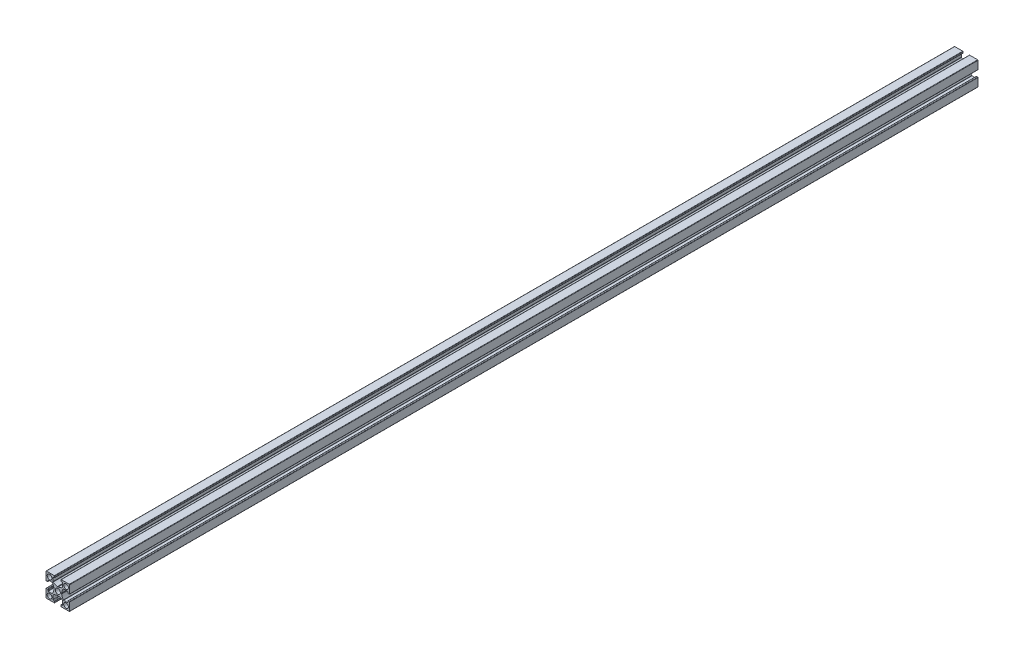
from build123d import *

# Parameters (mm, degrees)
MODEL_R         = 2.15
MODEL_R_2       = 2
EXTRUDE_1_DEPTH = 770


with BuildPart() as part:
    # Model → 보스-돌출1 (new body)
    with BuildSketch(Plane.XY):
        with BuildLine():
            Line((2307.763927197, 1192.134297913), (2307.763927197, 1195.391548465))
            ThreePointArc((2307.763927197, 1195.391548465), (2307.676059232, 1195.603680499), (2307.463927197, 1195.691548465))
            Line((2307.463927197, 1195.691548465), (2306.563927197, 1195.691548465))
            ThreePointArc((2306.563927197, 1195.691548465), (2306.351795163, 1195.779416431), (2306.263927197, 1195.991548465))
            Line((2306.263927197, 1195.991548465), (2306.263927197, 1196.891548465))
            ThreePointArc((2306.263927197, 1196.891548465), (2306.351795163, 1197.103680499), (2306.563927197, 1197.191548465))
            Line((2306.563927197, 1197.191548465), (2313.313927197, 1197.191548465))
            ThreePointArc((2313.313927197, 1197.191548465), (2313.526059232, 1197.103680499), (2313.613927197, 1196.891548465))
            Line((2313.613927197, 1196.891548465), (2313.613927197, 1190.141548465))
            ThreePointArc((2313.613927197, 1190.141548465), (2313.526059232, 1189.929416431), (2313.313927197, 1189.841548465))
            Line((2313.313927197, 1189.841548465), (2312.413927197, 1189.841548465))
            ThreePointArc((2312.413927197, 1189.841548465), (2312.201795163, 1189.929416431), (2312.113927197, 1190.141548465))
            Line((2312.113927197, 1190.141548465), (2312.113927197, 1191.041548465))
            ThreePointArc((2312.113927197, 1191.041548465), (2312.026059232, 1191.253680499), (2311.813927197, 1191.341548465))
            Line((2311.813927197, 1191.341548465), (2308.556676645, 1191.341548465))
            ThreePointArc((2308.556676645, 1191.341548465), (2308.426234796, 1191.311705686), (2308.321744595, 1191.228114625))
            ThreePointArc((2308.321744595, 1191.228114625), (2307.328306374, 1189.47356999), (2306.921204563, 1187.498825831))
            Line((2306.921204563, 1187.498825831), (2306.613927197, 1187.191548465))
            Line((2306.613927197, 1187.191548465), (2306.921204563, 1186.884271099))
            ThreePointArc((2306.921204563, 1186.884271099), (2307.328306374, 1184.90952694), (2308.321744595, 1183.154982305))
            ThreePointArc((2308.321744595, 1183.154982305), (2308.426234796, 1183.071391244), (2308.556676645, 1183.041548465))
            Line((2308.556676645, 1183.041548465), (2311.813927197, 1183.041548465))
            ThreePointArc((2311.813927197, 1183.041548465), (2312.026059232, 1183.129416431), (2312.113927197, 1183.341548465))
            Line((2312.113927197, 1183.341548465), (2312.113927197, 1184.241548465))
            ThreePointArc((2312.113927197, 1184.241548465), (2312.201795163, 1184.453680499), (2312.413927197, 1184.541548465))
            Line((2312.413927197, 1184.541548465), (2313.313927197, 1184.541548465))
            ThreePointArc((2313.313927197, 1184.541548465), (2313.526059232, 1184.453680499), (2313.613927197, 1184.241548465))
            Line((2313.613927197, 1184.241548465), (2313.613927197, 1177.491548465))
            ThreePointArc((2313.613927197, 1177.491548465), (2313.526059232, 1177.279416431), (2313.313927197, 1177.191548465))
            Line((2313.313927197, 1177.191548465), (2306.563927197, 1177.191548465))
            ThreePointArc((2306.563927197, 1177.191548465), (2306.351795163, 1177.279416431), (2306.263927197, 1177.491548465))
            Line((2306.263927197, 1177.491548465), (2306.263927197, 1178.391548465))
            ThreePointArc((2306.263927197, 1178.391548465), (2306.351795163, 1178.603680499), (2306.563927197, 1178.691548465))
            Line((2306.563927197, 1178.691548465), (2307.463927197, 1178.691548465))
            ThreePointArc((2307.463927197, 1178.691548465), (2307.676059232, 1178.779416431), (2307.763927197, 1178.991548465))
            Line((2307.763927197, 1178.991548465), (2307.763927197, 1182.248799017))
            ThreePointArc((2307.763927197, 1182.248799017), (2307.734084418, 1182.379240866), (2307.650493357, 1182.483731067))
            ThreePointArc((2307.650493357, 1182.483731067), (2305.895948722, 1183.477169289), (2303.921204563, 1183.884271099))
            Line((2303.921204563, 1183.884271099), (2303.613927197, 1184.191548465))
            Line((2303.613927197, 1184.191548465), (2303.306649831, 1183.884271099))
            ThreePointArc((2303.306649831, 1183.884271099), (2301.331905673, 1183.477169289), (2299.577361038, 1182.483731067))
            ThreePointArc((2299.577361038, 1182.483731067), (2299.493769977, 1182.379240866), (2299.463927197, 1182.248799017))
            Line((2299.463927197, 1182.248799017), (2299.463927197, 1178.991548465))
            ThreePointArc((2299.463927197, 1178.991548465), (2299.551795163, 1178.779416431), (2299.763927197, 1178.691548465))
            Line((2299.763927197, 1178.691548465), (2300.663927197, 1178.691548465))
            ThreePointArc((2300.663927197, 1178.691548465), (2300.876059232, 1178.603680499), (2300.963927197, 1178.391548465))
            Line((2300.963927197, 1178.391548465), (2300.963927197, 1177.491548465))
            ThreePointArc((2300.963927197, 1177.491548465), (2300.876059232, 1177.279416431), (2300.663927197, 1177.191548465))
            Line((2300.663927197, 1177.191548465), (2293.913927197, 1177.191548465))
            ThreePointArc((2293.913927197, 1177.191548465), (2293.701795163, 1177.279416431), (2293.613927197, 1177.491548465))
            Line((2293.613927197, 1177.491548465), (2293.613927197, 1184.241548465))
            ThreePointArc((2293.613927197, 1184.241548465), (2293.701795163, 1184.453680499), (2293.913927197, 1184.541548465))
            Line((2293.913927197, 1184.541548465), (2294.813927197, 1184.541548465))
            ThreePointArc((2294.813927197, 1184.541548465), (2295.026059232, 1184.453680499), (2295.113927197, 1184.241548465))
            Line((2295.113927197, 1184.241548465), (2295.113927197, 1183.341548465))
            ThreePointArc((2295.113927197, 1183.341548465), (2295.201795163, 1183.129416431), (2295.413927197, 1183.041548465))
            Line((2295.413927197, 1183.041548465), (2298.671177749, 1183.041548465))
            ThreePointArc((2298.671177749, 1183.041548465), (2298.801619599, 1183.071391244), (2298.906109799, 1183.154982305))
            ThreePointArc((2298.906109799, 1183.154982305), (2299.899548021, 1184.90952694), (2300.306649831, 1186.884271099))
            Line((2300.306649831, 1186.884271099), (2300.613927197, 1187.191548465))
            Line((2300.613927197, 1187.191548465), (2300.306649831, 1187.498825831))
            ThreePointArc((2300.306649831, 1187.498825831), (2299.899548021, 1189.47356999), (2298.906109799, 1191.228114625))
            ThreePointArc((2298.906109799, 1191.228114625), (2298.801619599, 1191.311705686), (2298.671177749, 1191.341548465))
            Line((2298.671177749, 1191.341548465), (2295.413927197, 1191.341548465))
            ThreePointArc((2295.413927197, 1191.341548465), (2295.201795163, 1191.253680499), (2295.113927197, 1191.041548465))
            Line((2295.113927197, 1191.041548465), (2295.113927197, 1190.141548465))
            ThreePointArc((2295.113927197, 1190.141548465), (2295.026059232, 1189.929416431), (2294.813927197, 1189.841548465))
            Line((2294.813927197, 1189.841548465), (2293.913927197, 1189.841548465))
            ThreePointArc((2293.913927197, 1189.841548465), (2293.701795163, 1189.929416431), (2293.613927197, 1190.141548465))
            Line((2293.613927197, 1190.141548465), (2293.613927197, 1196.891548465))
            ThreePointArc((2293.613927197, 1196.891548465), (2293.701795163, 1197.103680499), (2293.913927197, 1197.191548465))
            Line((2293.913927197, 1197.191548465), (2300.663927197, 1197.191548465))
            ThreePointArc((2300.663927197, 1197.191548465), (2300.876059232, 1197.103680499), (2300.963927197, 1196.891548465))
            Line((2300.963927197, 1196.891548465), (2300.963927197, 1195.991548465))
            ThreePointArc((2300.963927197, 1195.991548465), (2300.876059232, 1195.779416431), (2300.663927197, 1195.691548465))
            Line((2300.663927197, 1195.691548465), (2299.763927197, 1195.691548465))
            ThreePointArc((2299.763927197, 1195.691548465), (2299.551795163, 1195.603680499), (2299.463927197, 1195.391548465))
            Line((2299.463927197, 1195.391548465), (2299.463927197, 1192.134297913))
            ThreePointArc((2299.463927197, 1192.134297913), (2299.493769977, 1192.003856063), (2299.577361038, 1191.899365863))
            ThreePointArc((2299.577361038, 1191.899365863), (2301.331905673, 1190.905927641), (2303.306649831, 1190.498825831))
            Line((2303.306649831, 1190.498825831), (2303.613927197, 1190.191548465))
            Line((2303.613927197, 1190.191548465), (2303.921204563, 1190.498825831))
            ThreePointArc((2303.921204563, 1190.498825831), (2305.895948722, 1190.905927641), (2307.650493357, 1191.899365863))
            ThreePointArc((2307.650493357, 1191.899365863), (2307.734084418, 1192.003856063), (2307.763927197, 1192.134297913))
        make_face()
        with Locations((2303.613927197, 1187.191548465)):
            Circle(MODEL_R, mode=Mode.SUBTRACT)
        with Locations((2296.613927197, 1194.191548465)):
            Circle(MODEL_R_2, mode=Mode.SUBTRACT)
        with Locations((2296.613927197, 1180.191548465)):
            Circle(MODEL_R_2, mode=Mode.SUBTRACT)
        with Locations((2310.613927197, 1194.191548465)):
            Circle(MODEL_R_2, mode=Mode.SUBTRACT)
        with Locations((2310.613927197, 1180.191548465)):
            Circle(MODEL_R_2, mode=Mode.SUBTRACT)
    extrude(amount=EXTRUDE_1_DEPTH)


solid = part.part
